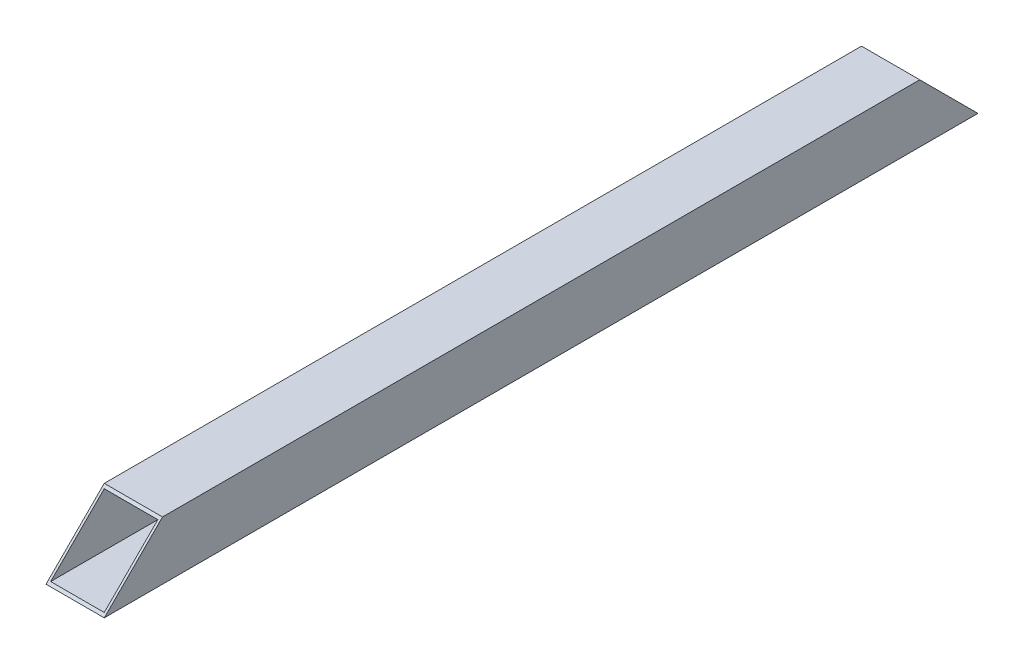
from build123d import *

# Parameters (mm, degrees)
CROQUIS1_W              = 100
CROQUIS1_H              = 100
CROQUIS1_W_2            = 92
CROQUIS1_H_2            = 92
SALIENTE_EXTRUIR2_DEPTH = 1500
CORTAR_EXTRUIR2_DEPTH   = 180


with BuildPart() as part:
    # Croquis1 → Saliente-Extruir2 (new body)
    with BuildSketch(Plane.XY):
        with Locations((-19.634513149, 9.769055649)):
            Rectangle(CROQUIS1_W, CROQUIS1_H)
        with Locations((-19.634513149, 9.769055649)):
            Rectangle(CROQUIS1_W_2, CROQUIS1_H_2, mode=Mode.SUBTRACT)
    extrude(amount=SALIENTE_EXTRUIR2_DEPTH)

    # Croquis2 → Cortar-Extruir2 (cut)
    with BuildSketch(Plane.ZY.offset(69.634513149)):
        Polygon((1500, -40.230944351), (1400, 59.769055649), (1500, 59.769055649), align=None)
        Polygon((0, -40.230944351), (100, 59.769055649), (0, 59.769055649), align=None)
    extrude(amount=-CORTAR_EXTRUIR2_DEPTH, mode=Mode.SUBTRACT)


solid = part.part
